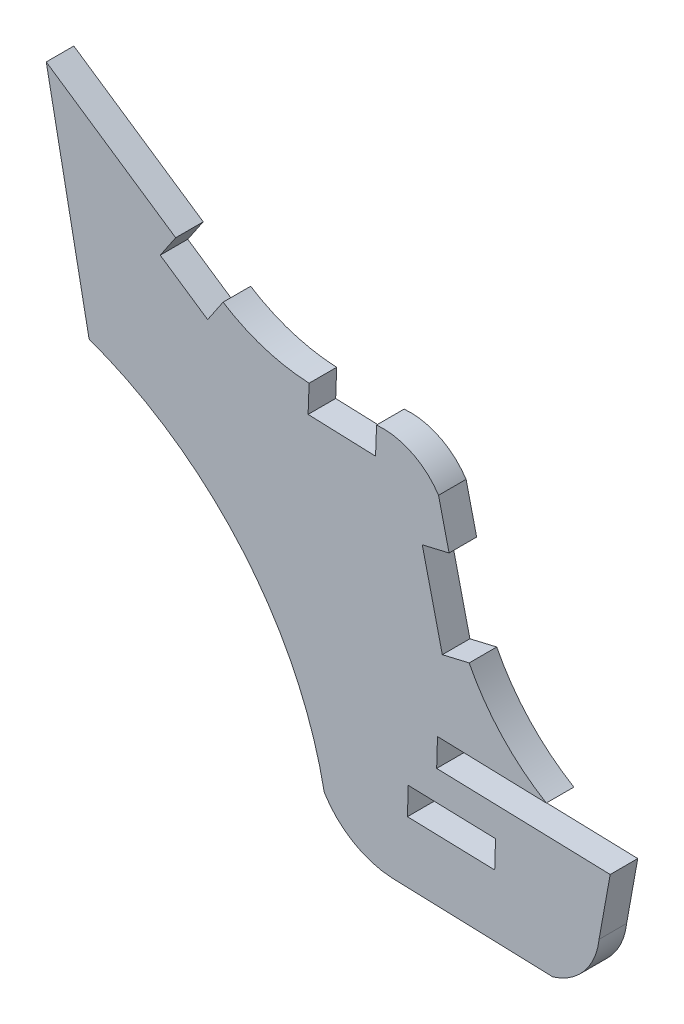
from build123d import *

# Parameters (mm, degrees)
BASE_EXTRUDE_DEPTH = 3


with BuildPart() as part:
    # Sketch1 → Base-Extrude (new body)
    with BuildSketch(Plane.XY):
        with BuildLine():
            Line((468.485101771, 336.766175753), (485.987733808, 336.188135391))
            ThreePointArc((485.987733808, 336.188135391), (489.416694784, 338.457661181), (491.026498899, 342.241449149))
            Line((491.026498899, 342.241449149), (492.238136306, 348.965913631))
            Line((492.238136306, 348.965913631), (473.355716317, 349.519727014))
            Line((473.355716317, 349.519727014), (473.445174068, 352.569813696))
            Line((473.445174068, 352.569813696), (485.286157606, 352.222522663))
            ThreePointArc((485.286157606, 352.222522663), (480.454254926, 356.13510234), (476.892234144, 361.230940955))
            Line((476.892234144, 361.230940955), (473.97203133, 360.543616051))
            Line((473.97203133, 360.543616051), (471.7909203, 369.810392981))
            Line((471.7909203, 369.810392981), (474.705571912, 370.496411305))
            Line((474.705571912, 370.496411305), (473.56015142, 375.362901844))
            ThreePointArc((473.56015142, 375.362901844), (470.637669512, 377.921889716), (466.815212769, 378.613369196))
            Line((466.815212769, 378.613369196), (466.789188287, 377.906806581))
            Line((466.789188287, 377.906806581), (466.704790084, 375.615402079))
            Line((466.704790084, 375.615402079), (459.364790084, 375.885752778))
            Line((459.364790084, 375.885752778), (459.475212769, 378.883719894))
            ThreePointArc((459.475212769, 378.883719894), (454.600522802, 379.746395641), (450.113675126, 381.838048014))
            Line((450.113675126, 381.838048014), (448.432649155, 379.353263982))
            Line((448.432649155, 379.353263982), (443.272580982, 382.844194581))
            Line((443.272580982, 382.844194581), (444.953606952, 385.328978613))
            Line((444.953606952, 385.328978613), (433.36986946, 393.165701366))
            Line((433.36986946, 393.165701366), (430.870547605, 394.856562582))
            Line((430.870547605, 394.856562582), (431.68884349, 390.680917334))
            Line((431.68884349, 390.680917334), (435.532374472, 371.067936044))
            ThreePointArc((435.532374472, 371.067936044), (452.26695125, 359.472706568), (461.126484264, 341.142292461))
            ThreePointArc((461.126484264, 341.142292461), (464.265694284, 338.046036211), (468.485101771, 336.766175753))
        make_face()
        Polygon((470.175766233, 343.382194878), (479.67168981, 343.103922683), (479.75956524, 346.102635392), (470.263641663, 346.380907586), align=None, mode=Mode.SUBTRACT)
    extrude(amount=BASE_EXTRUDE_DEPTH)


solid = part.part
